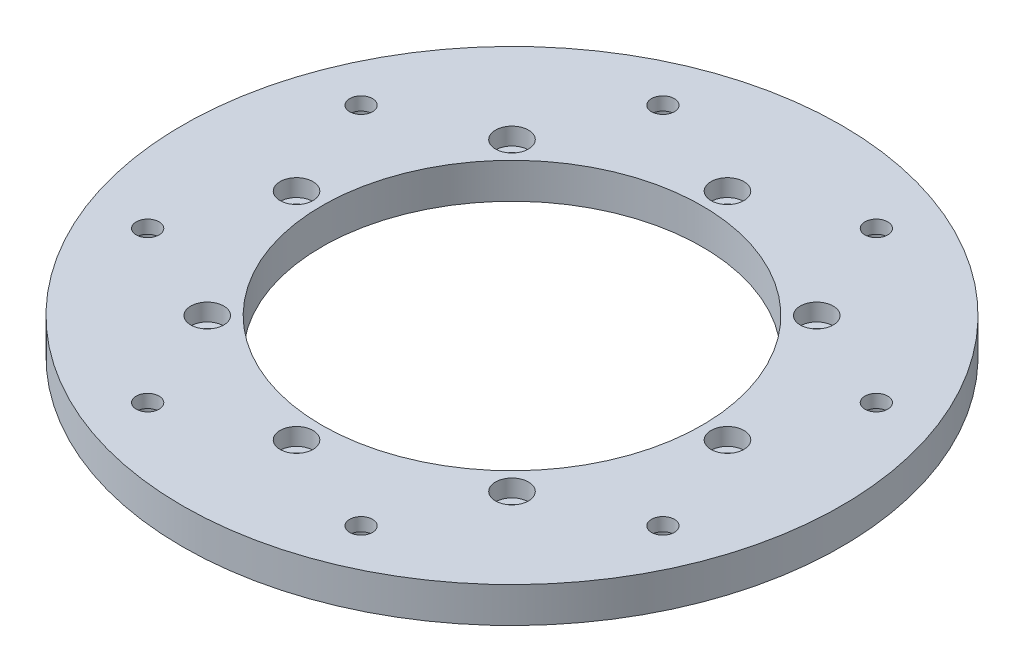
from build123d import *

# Parameters (mm, degrees)
SKETCH1_R                                           = 65
SKETCH1_R_2                                         = 37.5
BOSS_EXTRUDE1_DEPTH                                 = 7
CBORE_FOR_M3_HEX_SOCKET_HEAD_CAP_SCREW1_D           = 3.4
CBORE_FOR_M3_HEX_SOCKET_HEAD_CAP_SCREW1_CBORE_D     = 6.5
CBORE_FOR_M3_HEX_SOCKET_HEAD_CAP_SCREW1_CBORE_DEPTH = 3.4
CBORE_FOR_M4_HEX_SOCKET_HEAD_CAP_SCREW1_D           = 4.5
CBORE_FOR_M4_HEX_SOCKET_HEAD_CAP_SCREW1_CBORE_D     = 8
CBORE_FOR_M4_HEX_SOCKET_HEAD_CAP_SCREW1_CBORE_DEPTH = 4.4


with BuildPart() as part:
    # Sketch1 → Boss-Extrude1 (new body)
    with BuildSketch(Plane(origin=(0, 0, 0), x_dir=(1, 0, 0), z_dir=(0, 1, 0))):
        with Locations(Location((0, 0, 0), (0, 0, 270))):
            Circle(SKETCH1_R)
        with Locations(Location((0, 0, 0), (0, 0, 270))):
            Circle(SKETCH1_R_2, mode=Mode.SUBTRACT)
    extrude(amount=BOSS_EXTRUDE1_DEPTH)

    # CBORE for M3 Hex Socket Head Cap Screw1 (through all)
    with Locations(Plane(origin=(0, 7, 0), x_dir=(1, 0, 0), z_dir=(0, 1, 0))):
        with Locations((-30.0520382, 30.0520382), (0, 42.5), (30.0520382, 30.0520382), (42.5, 0), (30.0520382, -30.0520382), (0, -42.5), (-30.0520382, -30.0520382), (-42.5, 0)):
            CounterBoreHole(CBORE_FOR_M3_HEX_SOCKET_HEAD_CAP_SCREW1_D / 2, CBORE_FOR_M3_HEX_SOCKET_HEAD_CAP_SCREW1_CBORE_D / 2, CBORE_FOR_M3_HEX_SOCKET_HEAD_CAP_SCREW1_CBORE_DEPTH)

    # CBORE for M4 Hex Socket Head Cap Screw1 (through all)
    with Locations(Plane(origin=(0, 0, 0), x_dir=(-1, 0, 0), z_dir=(0, -1, 0))):
        with Locations((-50.813374288, -21.04758878), (-50.813374288, 21.04758878), (-21.04758878, 50.813374288), (21.04758878, 50.813374288), (50.813374288, 21.04758878), (50.813374288, -21.04758878), (21.04758878, -50.813374288), (-21.04758878, -50.813374288)):
            CounterBoreHole(CBORE_FOR_M4_HEX_SOCKET_HEAD_CAP_SCREW1_D / 2, CBORE_FOR_M4_HEX_SOCKET_HEAD_CAP_SCREW1_CBORE_D / 2, CBORE_FOR_M4_HEX_SOCKET_HEAD_CAP_SCREW1_CBORE_DEPTH)


solid = part.part
